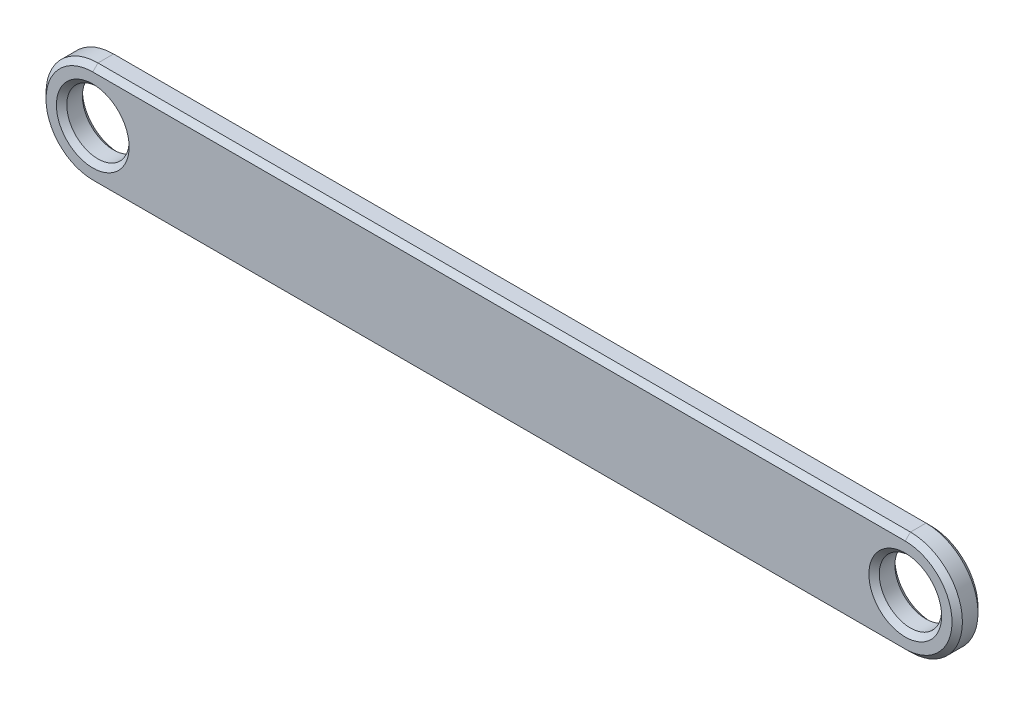
from build123d import *

# Parameters (mm, degrees)
SKETCH1_R           = 30
BOSS_EXTRUDE1_DEPTH = 25
CHAMFER1_SIZE       = 5


with BuildPart() as part:
    # Sketch1 → Boss-Extrude1 (new body)
    with BuildSketch(Plane.XY):
        with BuildLine():
            Line((390.915, -50), (-390.915, -50))
            ThreePointArc((-390.915, -50), (-440.915, 0), (-390.915, 50))
            Line((-390.915, 50), (390.915, 50))
            ThreePointArc((390.915, 50), (440.915, 0), (390.915, -50))
        make_face()
        with Locations((-390.915, 0)):
            Circle(SKETCH1_R, mode=Mode.SUBTRACT)
        with Locations(Location((390.915, 0, 0), (0, 0, 180))):
            Circle(SKETCH1_R, mode=Mode.SUBTRACT)
    extrude(amount=BOSS_EXTRUDE1_DEPTH)

    # Chamfer1
    chamfer1_edges = [part.edges().sort_by_distance(p)[0] for p in [
        (440.915, 0, 25),
        (-420.915, 0, 0),
        (-420.915, 0, 25),
        (0, 50, 25),
        (420.915, 0, 0),
        (420.915, 0, 25),
        (-440.915, 0, 25),
        (0, 50, 0),
        (440.915, 0, 0),
        (0, -50, 0),
        (-440.915, 0, 0),
        (0, -50, 25),
    ]]
    chamfer(chamfer1_edges, length=CHAMFER1_SIZE)


solid = part.part
